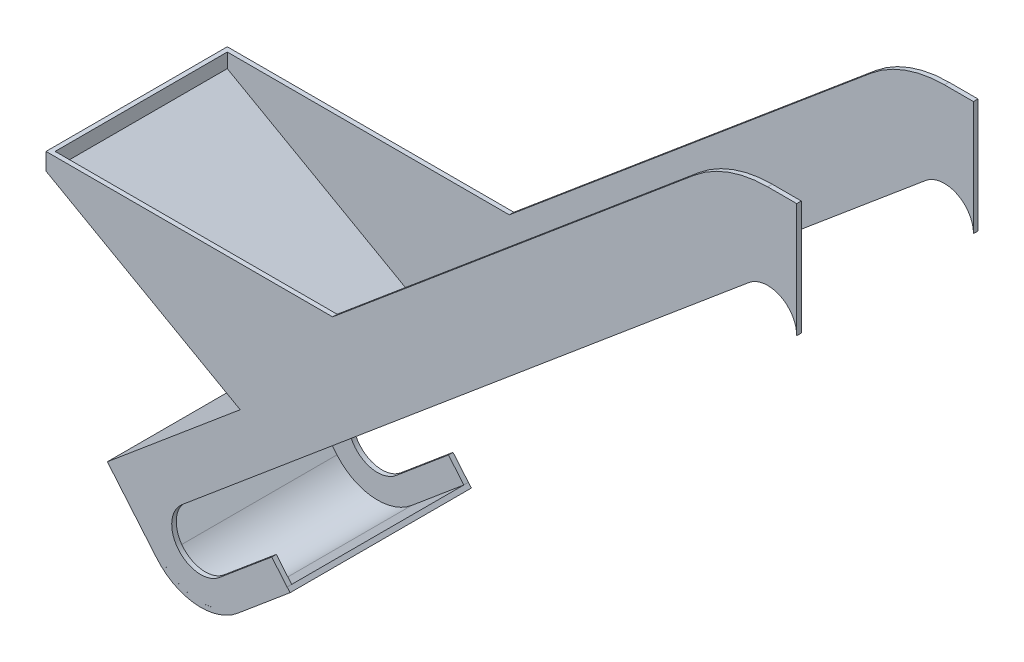
from build123d import *

# Parameters (mm, degrees)
EXTRUDE_1_DEPTH        = 4
PATTERN_LINEAR_1_COUNT = 2
PATTERN_LINEAR_1_PITCH = 310.4
SKETCH_7_W             = 395.874868567
SKETCH_7_H             = 318.4
EXTRUDE_2_DEPTH        = 8
SKETCH_8_W             = 318.4
SKETCH_8_H             = 30
EXTRUDE_3_DEPTH        = 8
SKETCH_9_W             = 298.07386306
SKETCH_9_H             = 318.4
EXTRUDE_4_DEPTH        = 4
EXTRUDE_5_DEPTH        = 318.4


with BuildPart() as part:
    # 草图4 → 凸台-拉伸1 (new, symmetric)
    with BuildSketch(Plane.XY):
        with BuildLine():
            Line((420.987802859, 562.886051953), (471.987802859, 562.886051953))
            Line((471.987802859, 562.886051953), (471.987802859, 361.886051953))
            ThreePointArc((471.987802859, 361.886051953), (442.540044204, 408.108350608), (388.203454114, 400.952488665))
            Line((388.203454114, 400.952488665), (-607.607677768, -434.726989137))
            ThreePointArc((-607.607677768, -434.726989137), (-613.889765736, -506.577774594), (-542.038980279, -512.859862561))
            Line((-542.038980279, -512.859862561), (-450.117952721, -435.720218456))
            Line((-450.117952721, -435.720218456), (-423.119077284, -467.892578102))
            Line((-423.119077284, -467.892578102), (-515.018746035, -545.014298008))
            ThreePointArc((-515.018746035, -545.014298008), (-582.867486655, -566.333113479), (-645.94139002, -533.475447539))
            Line((-645.94139002, -533.475447539), (-730.152226268, -433.128256555))
            Line((-730.152226268, -433.128256555), (-659.034107171, -373.446304098))
            Line((-659.034107171, -373.446304098), (-501.825094761, -241.51732561))
            Line((-501.825094761, -241.51732561), (-846.623641588, -47.015722354))
            Line((-846.623641588, -47.015722354), (-846.623641588, -17.015722354))
            Line((-846.623641588, -17.015722354), (-343.198253767, -17.015722354))
            Line((-343.198253767, -17.015722354), (291.778898983, 515.853773113))
            ThreePointArc((291.778898983, 515.853773113), (352.236482701, 550.762350034), (420.987802859, 562.886051953))
        make_face()
    extrude(amount=EXTRUDE_1_DEPTH, both=True)


with BuildPart() as pattern_linear_1_1:
    # 阵列(线性)1: pattern copy
    add(part.part.moved(Location(Vector(0, 0, 1) * (1 * PATTERN_LINEAR_1_PITCH))))


with BuildPart() as part_1:
    add(part.part)

    add(pattern_linear_1_1.part)  # 凸台-拉伸2 merges 阵列(线性)1_1
    # 草图7 → 凸台-拉伸2 (add)
    with BuildSketch(Plane(origin=(-224.491205057, -397.961970406, 0), x_dir=(0.870978620276557, -0.4913209165312884, 0), z_dir=(-0.4913209165312884, -0.870978620276557, 0))):
        with Locations((-516.353849163, 155.2)):
            Rectangle(SKETCH_7_W, SKETCH_7_H)
    extrude(amount=-EXTRUDE_2_DEPTH)

    # 草图8 → 凸台-拉伸3 (add)
    with BuildSketch(Plane.ZY.offset(846.623641588)):
        with Locations((155.2, -32.015722354)):
            Rectangle(SKETCH_8_W, SKETCH_8_H)
    extrude(amount=-EXTRUDE_3_DEPTH)

    # 草图9 → 凸台-拉伸4 (add, symmetric)
    with BuildSketch(Plane(origin=(-88.443218659, 105.390576195, 0), x_dir=(0.7660085629862927, 0.6428303675400493, 0), z_dir=(-0.6428303675400493, 0.7660085629862927, 0))):
        with Locations((-688.693922428, -155.2)):
            Rectangle(SKETCH_9_W, SKETCH_9_H)
    extrude(amount=EXTRUDE_4_DEPTH, both=True)

    # 草图10 → 凸台-拉伸5 (add)
    with BuildSketch(Plane.XY.offset(314.4)):
        with BuildLine():
            Line((-732.723547738, -430.064222303), (-645.94139002, -533.475447539))
            ThreePointArc((-645.94139002, -533.475447539), (-582.872198439, -566.386574546), (-515.018746035, -545.014298008))
            Line((-515.018746035, -545.014298008), (-423.119077284, -467.892578102))
            Line((-423.119077284, -467.892578102), (-417.802582401, -473.874750967))
            Line((-417.802582401, -473.874750967), (-509.876103095, -551.142366512))
            ThreePointArc((-509.876103095, -551.142366512), (-583.574554826, -574.355683374), (-652.076622248, -538.609541958))
            Line((-652.076622248, -538.609541958), (-738.851610287, -435.206860245))
            Line((-738.851610287, -435.206860245), (-732.723547738, -430.064222303))
        make_face()
    extrude(amount=-EXTRUDE_5_DEPTH)


solid = part_1.part
